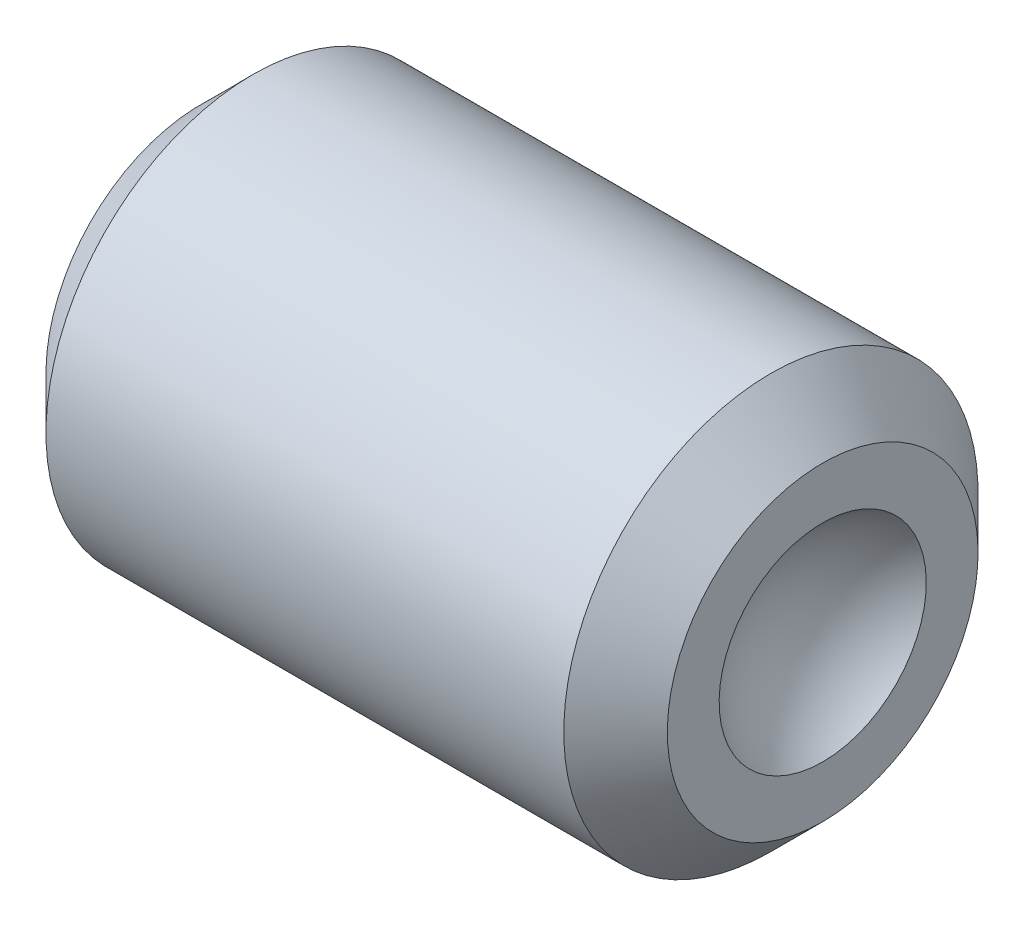
from build123d import *

# Parameters (mm, degrees)
CUT_EXTRUDE1_DEPTH = 4


with BuildPart() as part:
    # Sketch1 → Revolve1 (revolve)
    with BuildSketch(Plane.XY, mode=Mode.PRIVATE) as revolve1_sk:
        with BuildLine():
            Line((0, 0), (0, 1.5))
            Line((0, 1.5), (0.5, 2))
            Line((0.5, 2), (5.5, 2))
            Line((5.5, 2), (6, 1.5))
            Line((6, 1.5), (6, 1))
            ThreePointArc((6, 1), (5.631966011, 0.559016994), (5.5, 0))
            Line((5.5, 0), (0, 0))
        make_face()
    revolve(revolve1_sk.sketch.rotate(Axis((0, 0, 0), (1, 0, 0)), 180), axis=Axis((0, 0, 0), (1, 0, 0)))

    # Sketch2 → Cut-Extrude1 (cut)
    with BuildSketch(Plane.ZY):
        Polygon((0, 1.154700538), (-1, 0.577350269), (-1, -0.577350269), (0, -1.154700538), (1, -0.577350269), (1, 0.577350269), align=None)
    extrude(amount=-CUT_EXTRUDE1_DEPTH, mode=Mode.SUBTRACT)


solid = part.part
